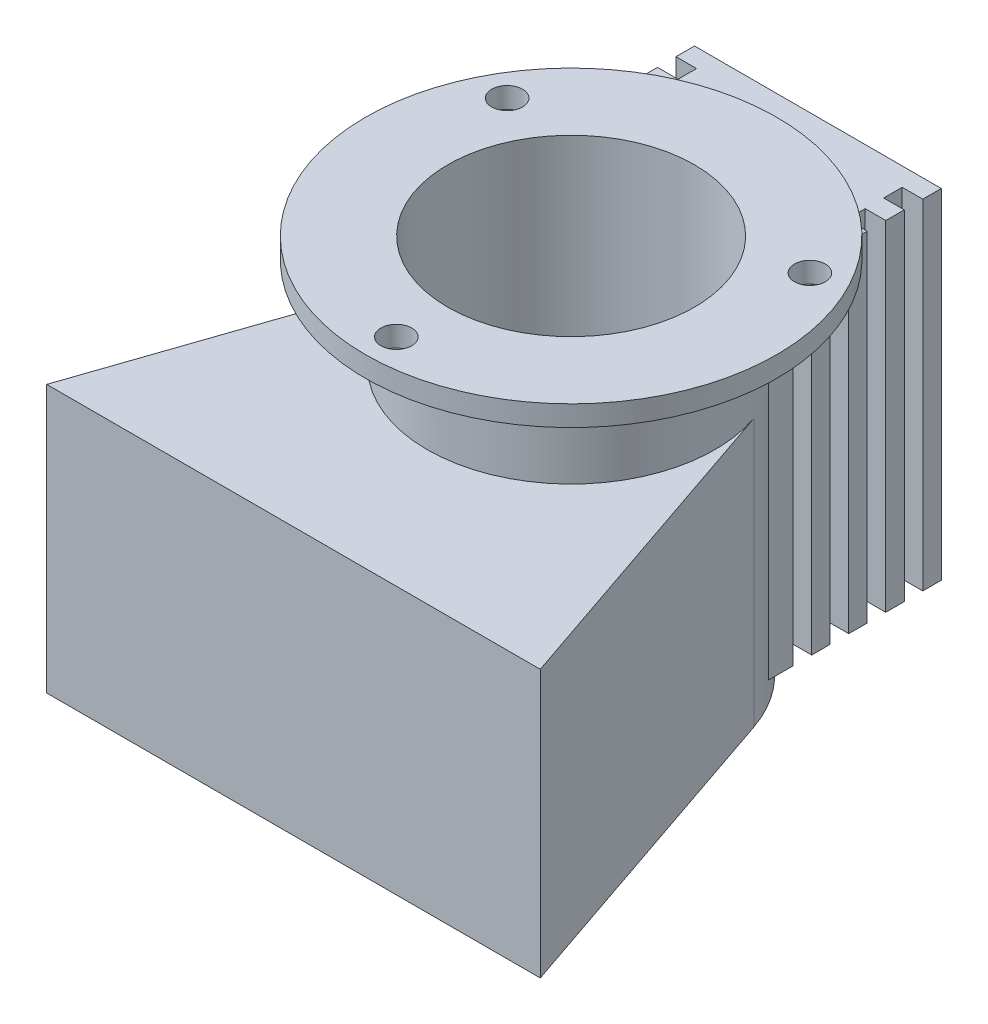
from build123d import *

# Parameters (mm, degrees)
BOSS_EXTRUDE2_DEPTH  = 8.75
BOSS_EXTRUDE3_DEPTH  = 6.5
SKETCH2_R            = 5
BOSS_EXTRUDE4_DEPTH  = 0.5
SKETCH4_W            = 6
SKETCH4_H            = 8.25
BOSS_EXTRUDE5_DEPTH  = 6
SKETCH5_W            = 0.5
SKETCH5_H            = 0.45
CUT_EXTRUDE2_DEPTH   = 13.57477634
LPATTERN1_COUNT      = 4
LPATTERN1_PITCH      = 0.9
LPATTERN1_COUNT_DIR2 = 2
LPATTERN1_PITCH_DIR2 = 5.5
SKETCH6_R            = 3
SKETCH6_R_2          = 0.75
CUT_EXTRUDE3_DEPTH   = 8.75
SKETCH7_R            = 0.75
CUT_EXTRUDE4_DEPTH   = 13.927683474
SKETCH8_R            = 0.375
CUT_EXTRUDE5_DEPTH   = 0.5


with BuildPart() as part:
    # Sketch1 → Boss-Extrude2 (new body)
    with BuildSketch(Plane(origin=(0, 0, 0), x_dir=(1, 0, 0), z_dir=(0, 1, 0))):
        with BuildLine():
            ThreePointArc((3.312648335, 1.129761483), (0, 3.5), (-3.312648335, 1.129761483))
            ThreePointArc((-3.312648335, 1.129761483), (-0.572595332, -3.45284442), (3.5, 0))
            ThreePointArc((3.5, 0), (3.45284442, 0.572595332), (3.312648335, 1.129761483))
        make_face()
    extrude(amount=BOSS_EXTRUDE2_DEPTH)

    # Sketch1<3> → Boss-Extrude3 (add)
    with BuildSketch(Plane(origin=(0, 0, 0), x_dir=(1, 0, 0), z_dir=(0, 1, 0))):
        with BuildLine():
            Line((-3.312648335, 1.129761483), (-6, -6.75))
            Line((-6, -6.75), (6, -6.75))
            Line((6, -6.75), (3.312648335, 1.129761483))
            ThreePointArc((3.312648335, 1.129761483), (3.45284442, 0.572595332), (3.5, 0))
            ThreePointArc((3.5, 0), (-0.572595332, -3.45284442), (-3.312648335, 1.129761483))
        make_face()
    extrude(amount=BOSS_EXTRUDE3_DEPTH)

    # Sketch2 → Boss-Extrude4 (add)
    with BuildSketch(Plane(origin=(0, 8.75, 0), x_dir=(1, 0, 0), z_dir=(0, 1, 0))):
        Circle(SKETCH2_R)
    extrude(amount=BOSS_EXTRUDE4_DEPTH)

    # Sketch4 → Boss-Extrude5 (add)
    with BuildSketch(Plane.XY.offset(-6)):
        with Locations((0, 4.625)):
            Rectangle(SKETCH4_W, SKETCH4_H)
    extrude(amount=BOSS_EXTRUDE5_DEPTH)

    # Sketch5 → Cut-Extrude2 (cut, through all)
    with BuildSketch(Plane(origin=(0, 8.75, 0), x_dir=(1, 0, 0), z_dir=(0, 1, 0))):
        with Locations((2.75, 5.325)):
            Rectangle(SKETCH5_W, SKETCH5_H)
    cut_extrude2 = extrude(amount=-CUT_EXTRUDE2_DEPTH, mode=Mode.SUBTRACT)

    # LPattern1: Cut-Extrude2 4 × 2
    with Locations(*[(-j * LPATTERN1_PITCH_DIR2, 0, i * LPATTERN1_PITCH) for i in range(LPATTERN1_COUNT) for j in range(LPATTERN1_COUNT_DIR2) if (i, j) != (0, 0)]):
        add(cut_extrude2, mode=Mode.SUBTRACT)

    # Sketch6 → Cut-Extrude3 (cut)
    with BuildSketch(Plane(origin=(0, 9.25, 0), x_dir=(1, 0, 0), z_dir=(0, 1, 0))):
        Circle(SKETCH6_R)
        Circle(SKETCH6_R_2, mode=Mode.SUBTRACT)
    extrude(amount=-CUT_EXTRUDE3_DEPTH, mode=Mode.SUBTRACT)

    # Sketch7 → Cut-Extrude4 (cut, through all)
    with BuildSketch(Plane(origin=(0, 9.25, 0), x_dir=(1, 0, 0), z_dir=(0, 1, 0))):
        Circle(SKETCH7_R)
    extrude(amount=-CUT_EXTRUDE4_DEPTH, mode=Mode.SUBTRACT)

    # Sketch8 → Cut-Extrude5 (cut)
    with BuildSketch(Plane(origin=(0, 9.25, 0), x_dir=(1, 0, 0), z_dir=(0, 1, 0))):
        with Locations((0, -4.25)):
            Circle(SKETCH8_R)
        with Locations((-3.680607966, 2.125)):
            Circle(SKETCH8_R)
        with Locations((3.680607966, 2.125)):
            Circle(SKETCH8_R)
    extrude(amount=-CUT_EXTRUDE5_DEPTH, mode=Mode.SUBTRACT)


solid = part.part
